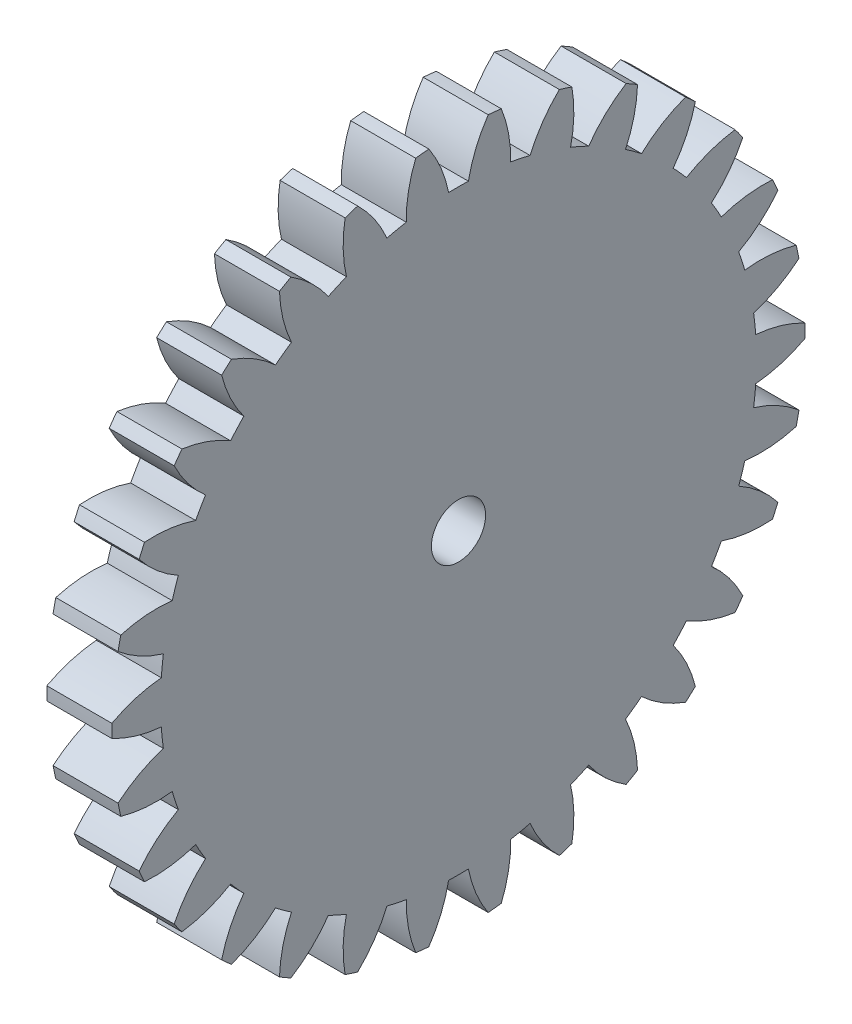
from build123d import *

# Parameters (mm, degrees)
BASPROSKE_W     = 12
BASPROSKE_H     = 64
TOOTHCUT_DEPTH  = 92.301697684
TEETHCUTS_COUNT = 30
TEETHCUTS_ANGLE = 348
BORSKE_R        = 5
BORE_DEPTH      = 50.0000508


with BuildPart() as part:
    # BasProSke → Base-Revolve (revolve)
    with BuildSketch(Plane(origin=(0, 0, 0), x_dir=(1, 0, 0), z_dir=(0, 1, 0)), mode=Mode.PRIVATE) as base_revolve_sk:
        with Locations((6, 32)):
            Rectangle(BASPROSKE_W, BASPROSKE_H)
    revolve(base_revolve_sk.sketch.rotate(Axis((-10, 0, 0), (1, 0, 0)), 180), axis=Axis((-10, 0, 0), (1, 0, 0)))

    # TooCutSke → ToothCut (cut, through all)
    with BuildSketch(Plane(origin=(0, 0, 0), x_dir=(0, 0, -1), z_dir=(1, 0, 0))):
        with BuildLine():
            ThreePointArc((1.826062386, 54.968677419), (0, 54.999), (-1.826062386, 54.968677419))
            ThreePointArc((-1.826062386, 54.968677419), (-3.216844615, 59.563303361), (-5.494219854, 63.789226311))
            ThreePointArc((-5.494219854, 63.789226311), (0, 64.0254), (5.494219854, 63.789226311))
            ThreePointArc((5.494219854, 63.789226311), (3.216844615, 59.563303361), (1.826062386, 54.968677419))
        make_face()
    toothcut = extrude(amount=TOOTHCUT_DEPTH, mode=Mode.SUBTRACT)

    # TeethCuts: ToothCut ×30 about axis
    teethcuts_axis = Axis((-10, 0, 0), (1, 0, 0))
    for i in range(1, TEETHCUTS_COUNT):
        add(toothcut.rotate(teethcuts_axis, i * TEETHCUTS_ANGLE / (TEETHCUTS_COUNT - 1)), mode=Mode.SUBTRACT)

    # BorSke → Bore (cut, symmetric)
    with BuildSketch(Plane(origin=(0, 0, 0), x_dir=(0, 0, -1), z_dir=(1, 0, 0))):
        with Locations(Location((0, 0, 0), (0, 0, 180))):
            Circle(BORSKE_R)
    extrude(amount=BORE_DEPTH, both=True, mode=Mode.SUBTRACT)


solid = part.part
